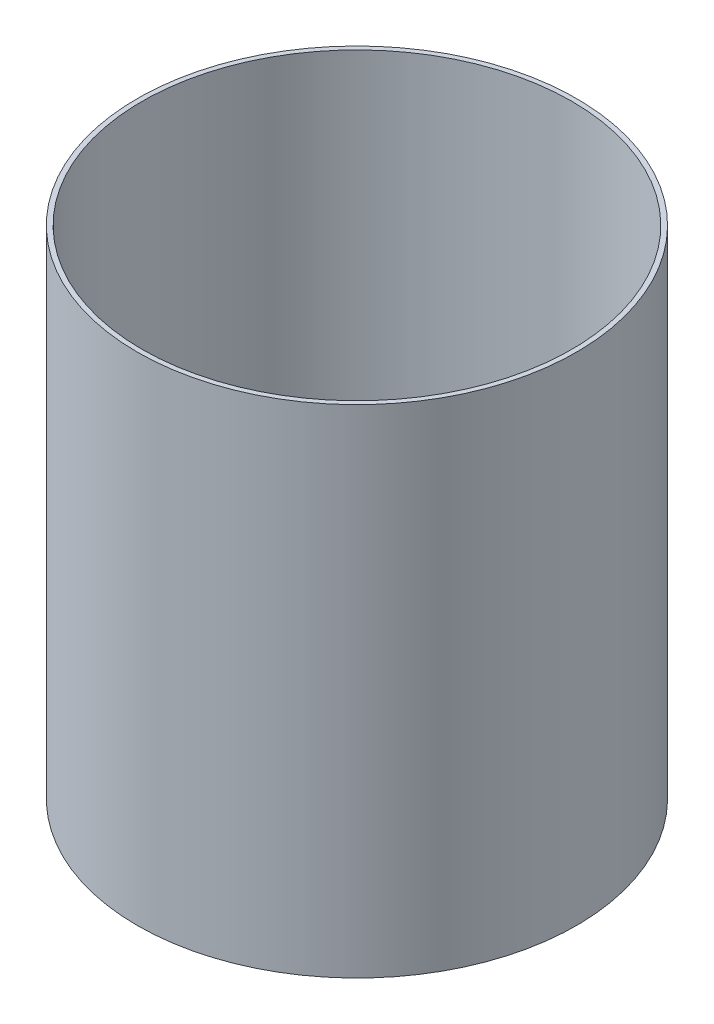
from build123d import *

# Parameters (mm, degrees)
SKETCH1_R               = 690
BOSS_EXTRUDE1_DEPTH     = 780
CUT_EXTRUDE1_DEPTH      = 1250.239768819
CUT_EXTRUDE1_DEPTH_BACK = 1250.239768819
SKETCH2_R               = 675


with BuildPart() as part:
    # Sketch1 → Boss-Extrude1 (new, symmetric)
    with BuildSketch(Plane(origin=(0, 0, 0), x_dir=(1, 0, 0), z_dir=(0, 1, 0))):
        with Locations(Location((0, 0, 0), (0, 0, 270))):
            Circle(SKETCH1_R)
    extrude(amount=BOSS_EXTRUDE1_DEPTH, both=True)

    # Sketch2 → Cut-Extrude1 (cut, two sides: drawn at the far end of the back side and taken through both)
    with BuildSketch(Plane(origin=(0, 0, 0), x_dir=(1, 0, 0), z_dir=(0, 1, 0)).offset(-CUT_EXTRUDE1_DEPTH_BACK)):
        with Locations(Location((0, 0, 0), (0, 0, 270))):
            Circle(SKETCH2_R)
    extrude(amount=CUT_EXTRUDE1_DEPTH + CUT_EXTRUDE1_DEPTH_BACK, mode=Mode.SUBTRACT)


solid = part.part
